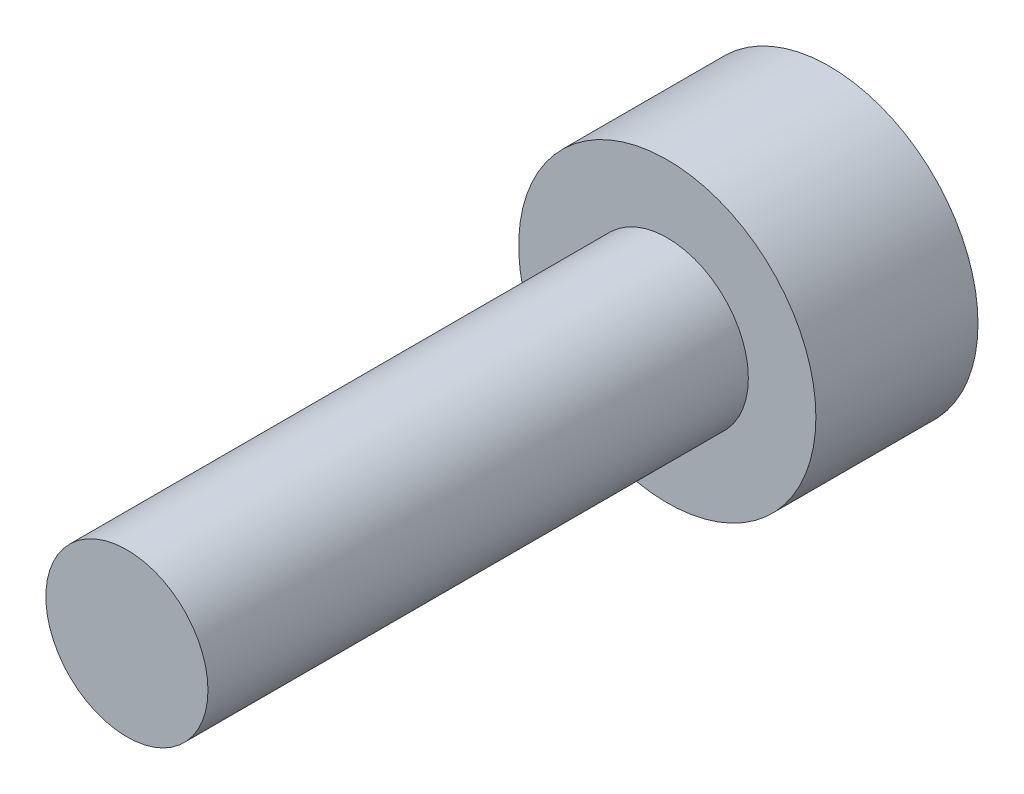
from build123d import *

# Parameters (mm, degrees)
SKETCH_1_R          = 2.75
EXTRUDE_1_DEPTH     = 3
SKETCH_2_R          = 1.5
EXTRUDE_2_DEPTH     = 10
CUT_EXTRUDE_1_DEPTH = 2


with BuildPart() as part:
    # ｽｹｯﾁ1 → ﾎﾞｽ - 押し出し1 (new body)
    with BuildSketch(Plane.XY):
        Circle(SKETCH_1_R)
    extrude(amount=EXTRUDE_1_DEPTH)

    # ｽｹｯﾁ2 → ﾎﾞｽ - 押し出し2 (add)
    with BuildSketch(Plane.XY.offset(3)):
        Circle(SKETCH_2_R)
    extrude(amount=EXTRUDE_2_DEPTH)

    # ｽｹｯﾁ3 → ｶｯﾄ - 押し出し1 (cut)
    with BuildSketch(Plane(origin=(0, 0, 0), x_dir=(-1, 0, 0), z_dir=(0, 0, -1))):
        Polygon((1.66357981, -0.399103763), (1.177423903, 1.241150495), (-0.486155907, 1.640254258), (-1.66357981, 0.399103763), (-1.177423903, -1.241150495), (0.486155907, -1.640254258), align=None)
    extrude(amount=-CUT_EXTRUDE_1_DEPTH, mode=Mode.SUBTRACT)


solid = part.part
